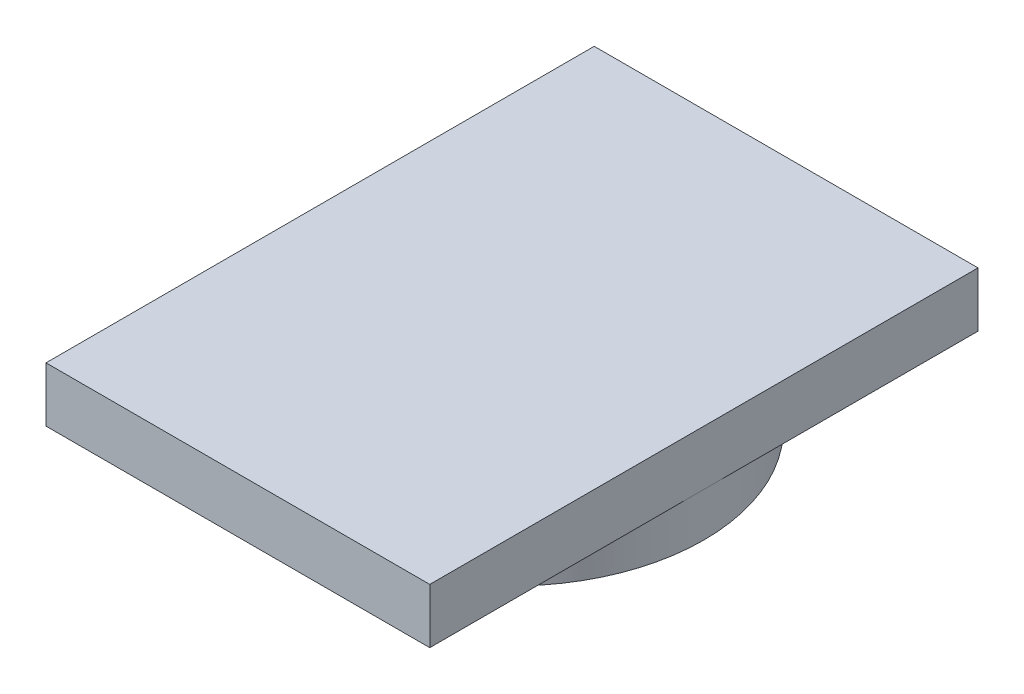
from build123d import *

# Parameters (mm, degrees)
SKETCH1_R           = 3.5
BOSS_EXTRUDE1_DEPTH = 0.8
SKETCH2_W           = 7
SKETCH2_H           = 10
BOSS_EXTRUDE2_DEPTH = 1


with BuildPart() as part:
    # Sketch1 → Boss-Extrude1 (new body)
    with BuildSketch(Plane(origin=(0, 0, 0), x_dir=(1, 0, 0), z_dir=(0, 1, 0))):
        with Locations(Location((0, 0, 0), (0, 0, 270))):
            Circle(SKETCH1_R)
    extrude(amount=BOSS_EXTRUDE1_DEPTH)

    # Sketch2 → Boss-Extrude2 (add)
    with BuildSketch(Plane(origin=(0, 0.8, 0), x_dir=(1, 0, 0), z_dir=(0, 1, 0))):
        Rectangle(SKETCH2_W, SKETCH2_H)
    extrude(amount=BOSS_EXTRUDE2_DEPTH)


solid = part.part
